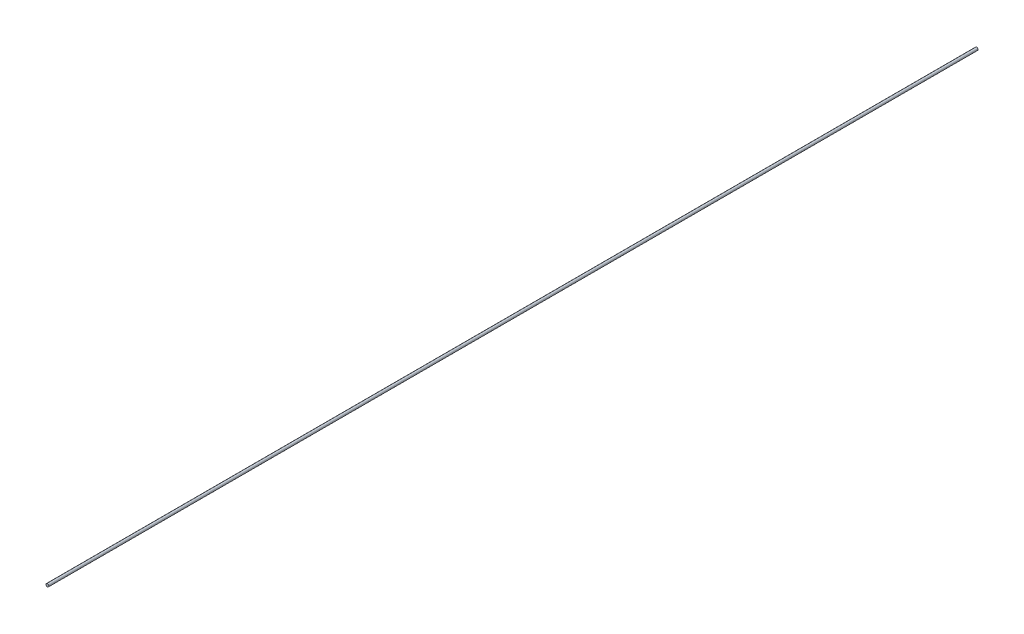
from build123d import *

# Parameters (mm, degrees)
SKETCH1_R           = 1.5
BOSS_EXTRUDE1_DEPTH = 1000


with BuildPart() as part:
    # Sketch1 → Boss-Extrude1 (new body)
    with BuildSketch(Plane.XY):
        Circle(SKETCH1_R)
    extrude(amount=BOSS_EXTRUDE1_DEPTH)


solid = part.part
